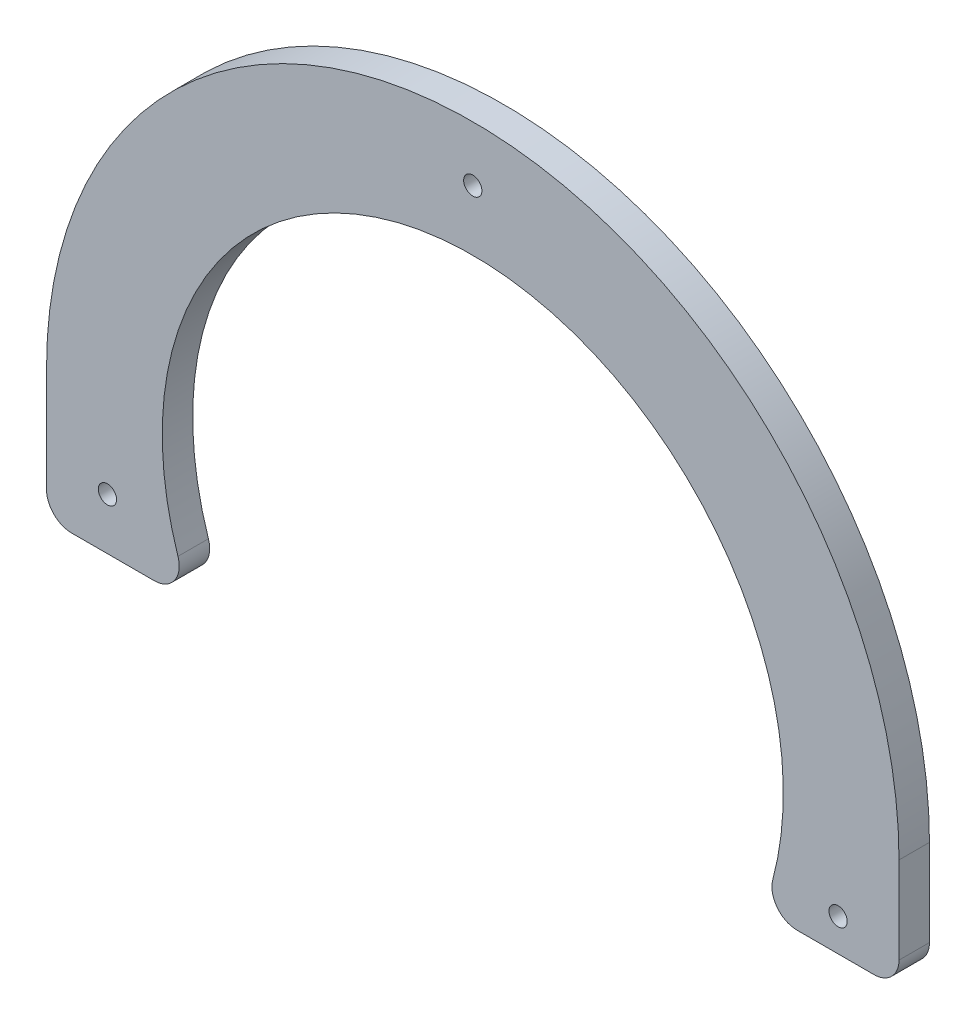
from build123d import *

# Parameters (mm, degrees)
SKETCH1_R                   = 1.5
Y_KSEKLIK_EKSTR_ZYON1_DEPTH = 2.5


with BuildPart() as part:
    # Sketch1 → Yükseklik-Ekstrüzyon1 (new, symmetric)
    with BuildSketch(Plane.XY):
        with BuildLine():
            Line((-43.160520199, 10.421906731), (-55.793069396, 10.421906731))
            ThreePointArc((-55.793069396, 10.421906731), (-59.061190769, 12.033165476), (-59.773103822, 15.606672417))
            ThreePointArc((-59.773103822, 15.606672417), (-110.527372239, 79.765345936), (-157.455994445, 12.757618261))
            ThreePointArc((-157.455994445, 12.757618261), (-158.027333354, 9.050297499), (-161.3672053, 7.34269369))
            Line((-161.3672053, 7.34269369), (-174.920520263, 7.34269369))
            ThreePointArc((-174.920520263, 7.34269369), (-177.833800201, 8.549413752), (-179.040520263, 11.46269369))
            Line((-179.040520263, 11.46269369), (-179.040520263, 28.787024355))
            ThreePointArc((-179.040520263, 28.787024355), (-109.040520263, 98.787024355), (-39.040520263, 28.787024355))
            Line((-39.040520263, 28.787024355), (-39.040520263, 14.54118218))
            ThreePointArc((-39.040520263, 14.54118218), (-40.247496439, 11.628370637), (-43.160520199, 10.421906731))
        make_face()
        with Locations((-169.040520263, 15.783267045)):
            Circle(SKETCH1_R, mode=Mode.SUBTRACT)
        with Locations((-49.040520263, 15.783267045)):
            Circle(SKETCH1_R, mode=Mode.SUBTRACT)
        with Locations((-109.040520263, 89.703931552)):
            Circle(SKETCH1_R, mode=Mode.SUBTRACT)
    extrude(amount=Y_KSEKLIK_EKSTR_ZYON1_DEPTH, both=True)


solid = part.part
